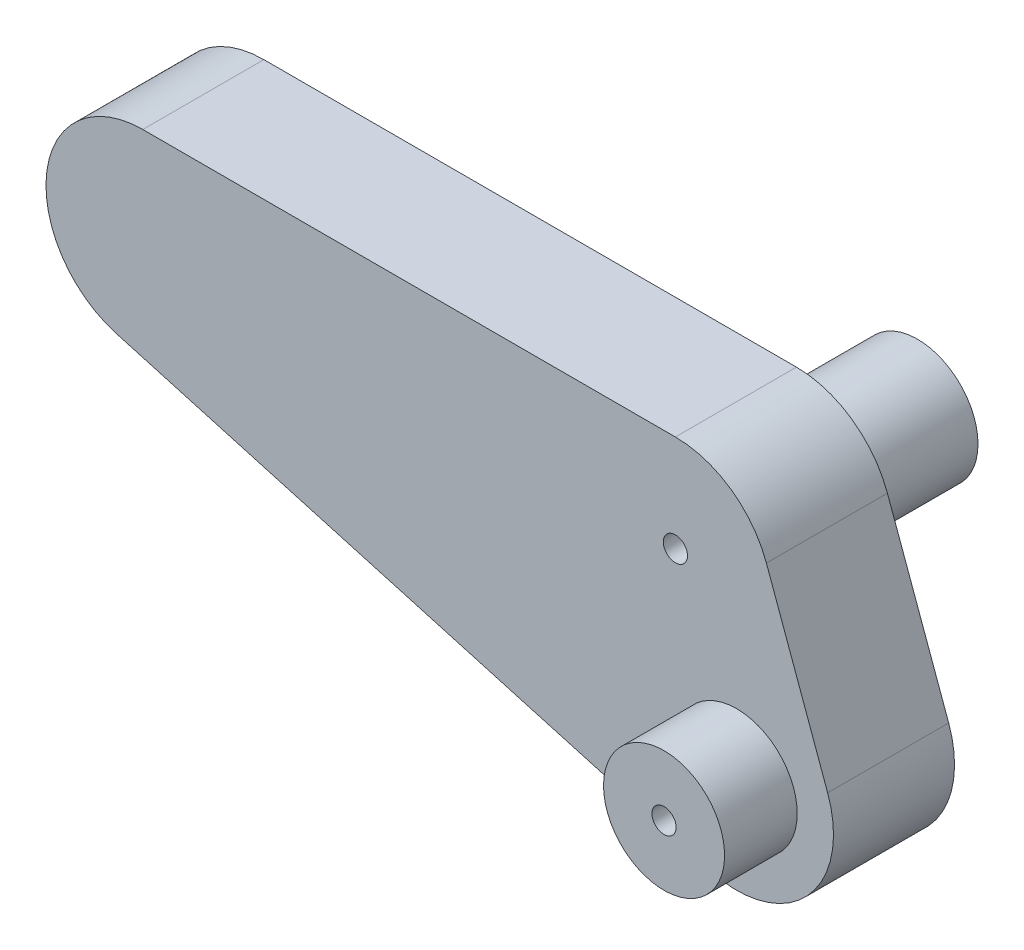
from build123d import *

# Parameters (mm, degrees)
SKETCH2_R           = 2.5
BOSS_EXTRUDE1_DEPTH = 5
BOSS_EXTRUDE2_START = -10
SKETCH3_R           = 2.5
SKETCH3_R_2         = 0.5
BOSS_EXTRUDE2_DEPTH = 10
SKETCH4_R           = 2.5
SKETCH4_R_2         = 0.5
BOSS_EXTRUDE3_DEPTH = 8
SKETCH5_R           = 2.5
BOSS_EXTRUDE4_DEPTH = 5


with BuildPart() as part:
    # Sketch2 → Boss-Extrude1 (new body)
    with BuildSketch(Plane.XY):
        with BuildLine():
            Line((-22, 4), (0, 4))
            ThreePointArc((0, 4), (2.294305745, 3.276608177), (3.758770483, 1.368080573))
            Line((3.758770483, 1.368080573), (6.289719544, -5.585644821))
            ThreePointArc((6.289719544, -5.585644821), (5.460495491, -9.677281472), (1.44006103, -10.802096907))
            Line((1.44006103, -10.802096907), (-23.090888031, -3.848371513))
            ThreePointArc((-23.090888031, -3.848371513), (-25.961911537, 0.550687728), (-22, 4))
        make_face()
        with Locations((-22, 0)):
            Circle(SKETCH2_R, mode=Mode.SUBTRACT)
        Circle(SKETCH2_R, mode=Mode.SUBTRACT)
        with Locations((2.530949061, -6.953725394)):
            Circle(SKETCH2_R, mode=Mode.SUBTRACT)
    extrude(amount=BOSS_EXTRUDE1_DEPTH)

    # Sketch3 → Boss-Extrude2 (add)
    with BuildSketch(Plane.XY.offset(5).offset(BOSS_EXTRUDE2_START)):
        Circle(SKETCH3_R)
        Circle(SKETCH3_R_2, mode=Mode.SUBTRACT)
    extrude(amount=BOSS_EXTRUDE2_DEPTH)

    # Sketch4 → Boss-Extrude3 (add)
    with BuildSketch(Plane(origin=(0, 0, 0), x_dir=(-1, 0, 0), z_dir=(0, 0, -1))):
        with Locations((-2.530949061, -6.953725394)):
            Circle(SKETCH4_R)
        with Locations((-2.530949061, -6.953725394)):
            Circle(SKETCH4_R_2, mode=Mode.SUBTRACT)
    extrude(amount=-BOSS_EXTRUDE3_DEPTH)

    # Sketch5 → Boss-Extrude4 (add)
    with BuildSketch(Plane(origin=(0, 0, 0), x_dir=(-1, 0, 0), z_dir=(0, 0, -1))):
        with Locations((22, 0)):
            Circle(SKETCH5_R)
    extrude(amount=-BOSS_EXTRUDE4_DEPTH)


solid = part.part
